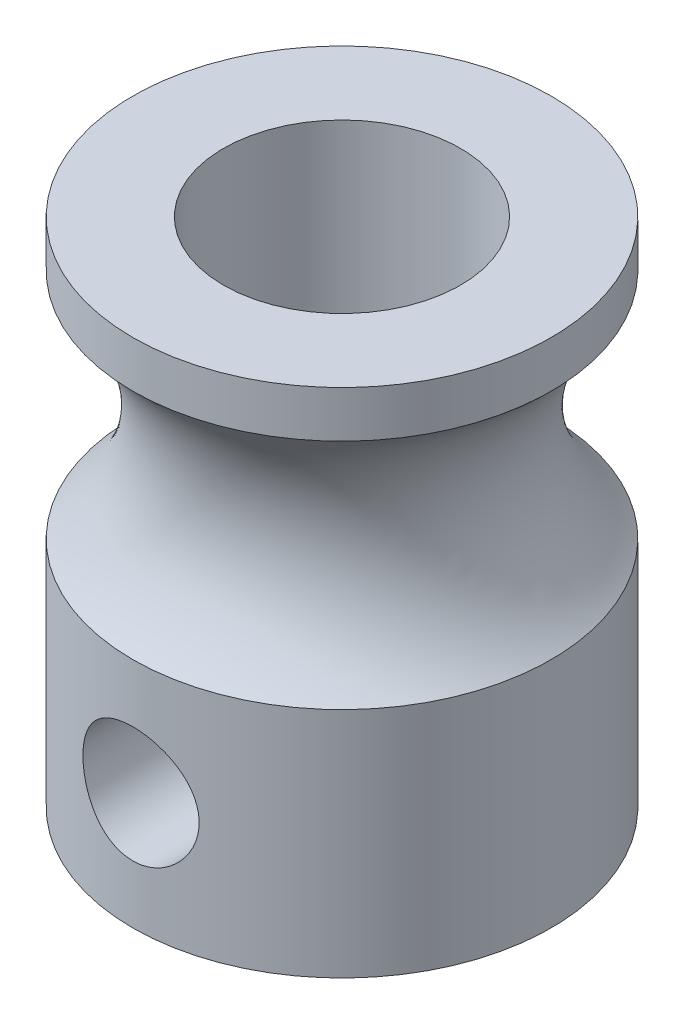
from build123d import *

# Parameters (mm, degrees)
CROQUIS1_R              = 4.5
CROQUIS1_R_2            = 2.55
SALIENTE_EXTRUIR1_DEPTH = 11
CROQUIS3_R              = 3.292391304
CROQUIS5_W              = 1.25
CROQUIS5_H              = 4.5


with BuildPart() as part:
    # Croquis1 → Saliente-Extruir1 (new body)
    with BuildSketch(Plane(origin=(0, 0, 0), x_dir=(1, 0, 0), z_dir=(0, 1, 0))):
        with Locations(Location((0, 0, 0), (0, 0, 270))):
            Circle(CROQUIS1_R)
        with Locations(Location((0, 0, 0), (0, 0, 270))):
            Circle(CROQUIS1_R_2, mode=Mode.SUBTRACT)
    extrude(amount=SALIENTE_EXTRUIR1_DEPTH)

    # Croquis3 → Cortar-Revolución1 (revolve, cut)
    with BuildSketch(Plane(origin=(0, 0, 0), x_dir=(0, 0, -1), z_dir=(1, 0, 0))):
        with Locations((-6.642391304, 7.5)):
            Circle(CROQUIS3_R)
    revolve(axis=Axis((0, 11, 0), (0, -1, 0)), mode=Mode.SUBTRACT)

    # Croquis5 → Taladro roscado M31 (revolve, cut)
    with BuildSketch(Plane(origin=(0, 2.5, 0), x_dir=(0, 1, 0), z_dir=(1, 0, 0))):
        with Locations((0.625, 2.25)):
            Rectangle(CROQUIS5_W, CROQUIS5_H)
    revolve(axis=Axis((0, 2.5, -6.35), (0, 0, 1)), mode=Mode.SUBTRACT)


solid = part.part
